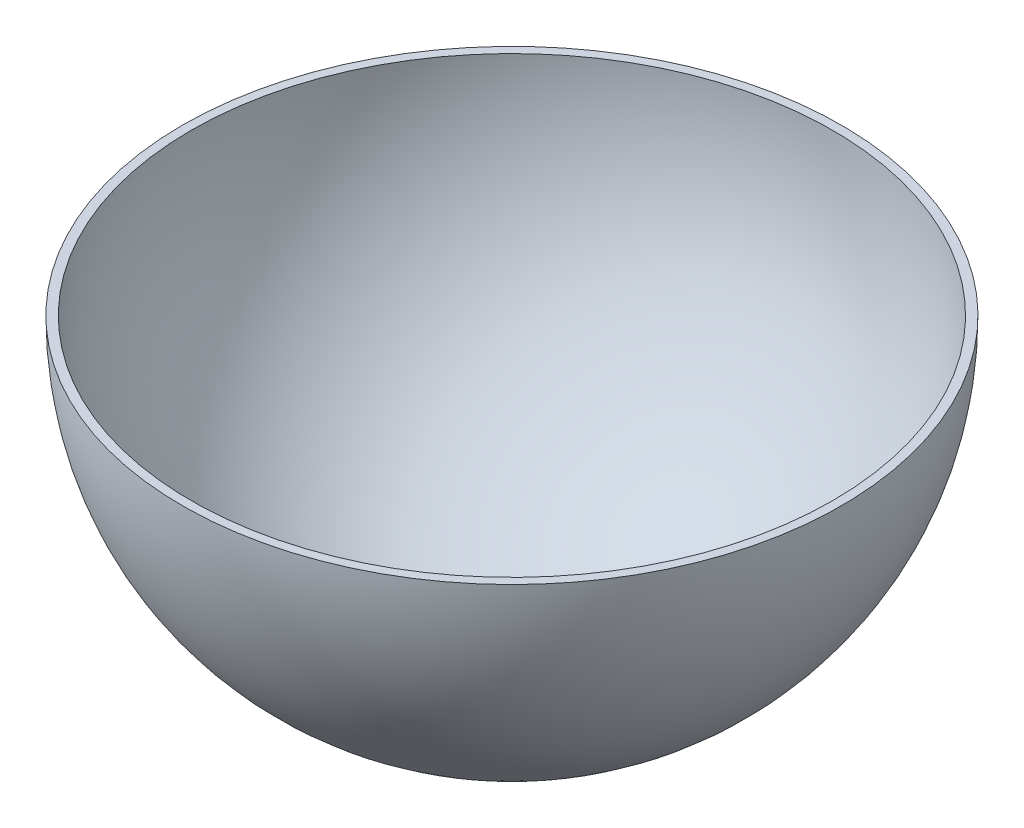
from build123d import *

# Parameters (mm, degrees)
SHELL_1_T = -2


with BuildPart() as part:
    # 草图1 → 旋转1 (revolve)
    with BuildSketch(Plane.XY, mode=Mode.PRIVATE) as revolve_1_sk:
        with BuildLine():
            Line((0, 0), (75, 0))
            ThreePointArc((75, 0), (56.658557963, -49.140694028), (10.605125079, -74.246422958))
            Line((10.605125079, -74.246422958), (0, -74.246422958))
            Line((0, -74.246422958), (0, 0))
        make_face()
    revolve(revolve_1_sk.sketch.rotate(Axis((0, 0, 0), (0, -1, 0)), 180), axis=Axis((0, 0, 0), (0, -1, 0)))

    # 抽壳1
    shell_1_openings = [part.faces().sort_by_distance(p)[0] for p in [
        (0, 0, 0),
    ]]
    offset(amount=SHELL_1_T, openings=shell_1_openings, kind=Kind.INTERSECTION)


solid = part.part
